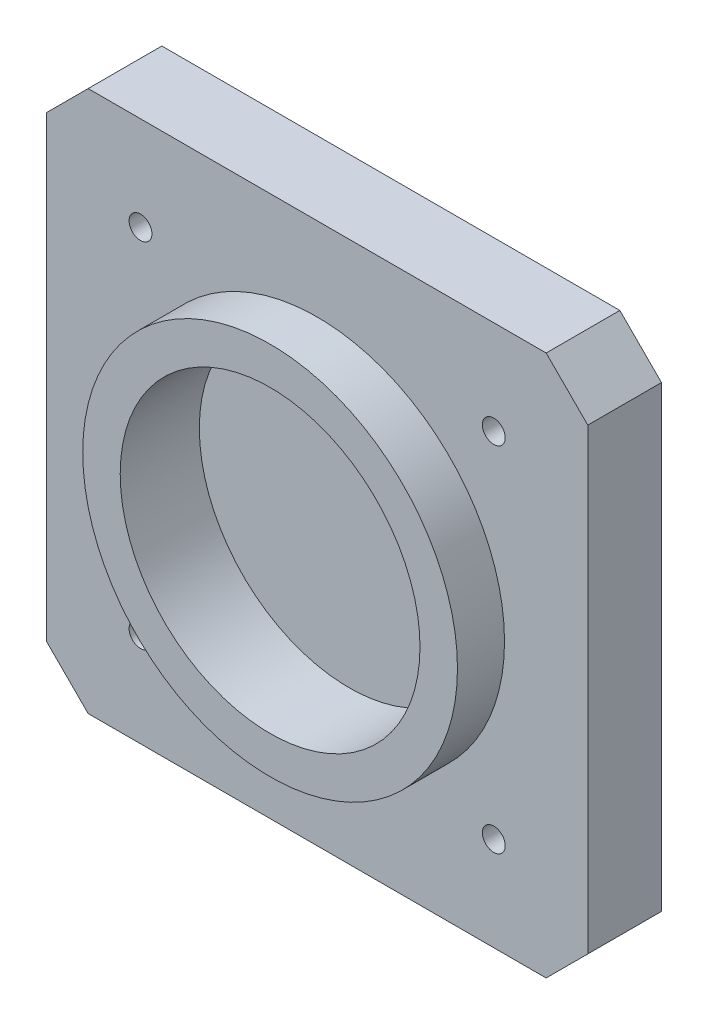
from build123d import *

# Parameters (mm, degrees)
SKETCH_1_R                = 45
SKETCH_1_R_2              = 36
EXTRUDE_1_DEPTH           = 19
SKETCH_1_3_W              = 130
SKETCH_1_3_H              = 130
SKETCH_1_3_R              = 2.5
EXTRUDE_2_DEPTH           = 10
EXTRUDE_START             = 7.7
SKETCH_1_4_W              = 130
SKETCH_1_4_H              = 130
SKETCH_1_4_R              = 2.5
SKETCH_1_4_R_2            = 45
EXTRUDE_3_DEPTH           = 7.7
HOLE_WIZARD_1_D           = 5.5
HOLE_WIZARD_1_CBORE_D     = 10
HOLE_WIZARD_1_CBORE_DEPTH = 5.7
CHAMFER_1_SIZE            = 10


with BuildPart() as part:
    # 草图1 → 凸台-拉伸1 (new body)
    with BuildSketch(Plane.XY):
        Circle(SKETCH_1_R)
        Circle(SKETCH_1_R_2, mode=Mode.SUBTRACT)
    extrude(amount=EXTRUDE_1_DEPTH)

    # 草图1<3> → 凸台-拉伸2 (add)
    with BuildSketch(Plane.XY):
        Rectangle(SKETCH_1_3_W, SKETCH_1_3_H)
        with Locations((-42.426406871, -42.426406871)):
            Circle(SKETCH_1_3_R, mode=Mode.SUBTRACT)
        with Locations((42.426406871, -42.426406871)):
            Circle(SKETCH_1_3_R, mode=Mode.SUBTRACT)
        with Locations((-42.426406871, 42.426406871)):
            Circle(SKETCH_1_3_R, mode=Mode.SUBTRACT)
        with Locations((42.426406871, 42.426406871)):
            Circle(SKETCH_1_3_R, mode=Mode.SUBTRACT)
    extrude(amount=-EXTRUDE_2_DEPTH)

    # 草图1<4> → 凸台-拉伸3 (add)
    with BuildSketch(Plane.XY.offset(EXTRUDE_START)):
        Rectangle(SKETCH_1_4_W, SKETCH_1_4_H)
        with Locations((-42.426406871, -42.426406871)):
            Circle(SKETCH_1_4_R, mode=Mode.SUBTRACT)
        with Locations((42.426406871, -42.426406871)):
            Circle(SKETCH_1_4_R, mode=Mode.SUBTRACT)
        with Locations((-42.426406871, 42.426406871)):
            Circle(SKETCH_1_4_R, mode=Mode.SUBTRACT)
        Circle(SKETCH_1_4_R_2, mode=Mode.SUBTRACT)
        with Locations((42.426406871, 42.426406871)):
            Circle(SKETCH_1_4_R, mode=Mode.SUBTRACT)
    extrude(amount=-EXTRUDE_3_DEPTH)

    # 打孔尺寸(%根据)内六角圆柱头螺钉的类型1 (through all)
    with Locations(Plane(origin=(0, 0, -10), x_dir=(-1, 0, 0), z_dir=(0, 0, -1))):
        with Locations((42.426406871, 42.426406871), (-42.426406871, 42.426406871), (42.426406871, -42.426406871), (-42.426406871, -42.426406871)):
            CounterBoreHole(HOLE_WIZARD_1_D / 2, HOLE_WIZARD_1_CBORE_D / 2, HOLE_WIZARD_1_CBORE_DEPTH)

    # 倒角1
    chamfer_1_edges = [part.edges().sort_by_distance(p)[0] for p in [
        (-65, -65, -1.15),
        (-65, 65, -1.15),
        (65, -65, -1.15),
        (65, 65, -1.15),
    ]]
    chamfer(chamfer_1_edges, length=CHAMFER_1_SIZE)


solid = part.part
